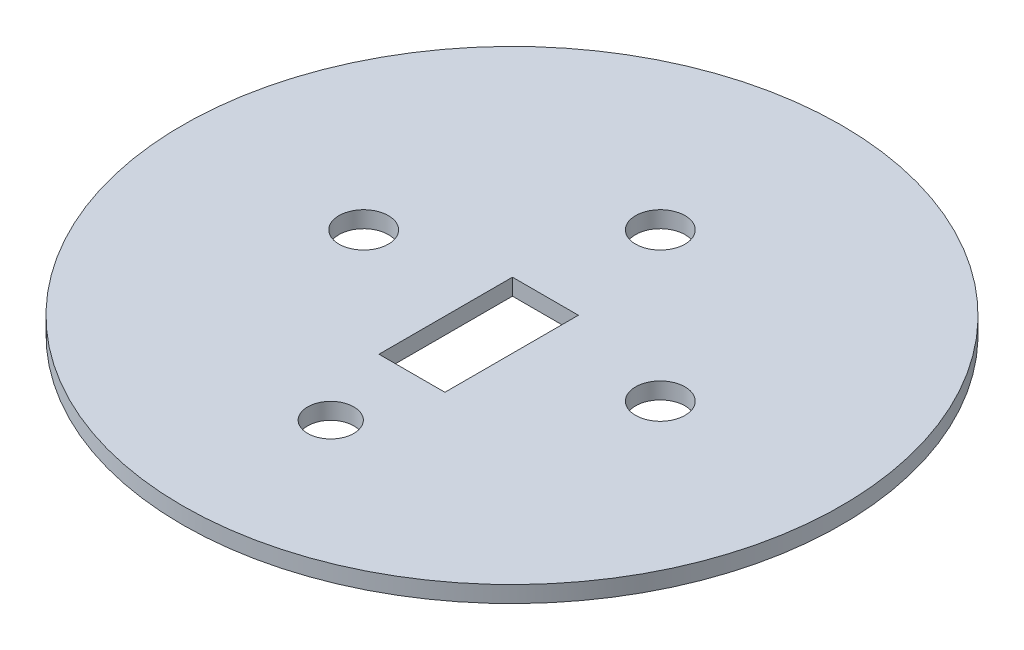
from build123d import *

# Parameters (mm, degrees)
SKETCH2_R           = 100
BOSS_EXTRUDE1_DEPTH = 2.5
CUT_EXTRUDE1_DEPTH  = 2.5
CUT_EXTRUDE2_DEPTH  = 10
SKETCH6_R           = 7.5
SKETCH6_R_2         = 7
CUT_EXTRUDE3_DEPTH  = 10


with BuildPart() as part:
    # Sketch2 → Boss-Extrude1 (new, symmetric)
    with BuildSketch(Plane(origin=(0, 0, 0), x_dir=(1, 0, 0), z_dir=(0, 1, 0))):
        with Locations(Location((0, 0, 0), (0, 0, 270))):
            Circle(SKETCH2_R)
    extrude(amount=BOSS_EXTRUDE1_DEPTH, both=True)

    # Sketch3 → Cut-Extrude1 (cut)
    with BuildSketch(Plane.XZ.offset(2.5)):
        Polygon((-65, 0), (-65, -50), (-55, -50), (-55, 50), (-65, 50), align=None)
        Polygon((55, 50), (65, 50), (65, 0), (65, -50), (55, -50), align=None)
    extrude(amount=-CUT_EXTRUDE1_DEPTH, mode=Mode.SUBTRACT)

    # Sketch5 → Cut-Extrude2 (cut)
    with BuildSketch(Plane.XZ.offset(2.5)):
        Polygon((0, 30.36), (10, 30.36), (10, -10.14), (-10, -10.14), (-10, 30.36), align=None)
    extrude(amount=-CUT_EXTRUDE2_DEPTH, mode=Mode.SUBTRACT)

    # Sketch6 → Cut-Extrude3 (cut)
    with BuildSketch(Plane.XZ.offset(2.5)):
        with Locations(Location((-45, 0, 0), (0, 0, 270))):
            Circle(SKETCH6_R)
        with Locations(Location((0, -45, 0), (0, 0, 270))):
            Circle(SKETCH6_R)
        with Locations(Location((45, 0, 0), (0, 0, 270))):
            Circle(SKETCH6_R)
        with Locations(Location((0, 55, 0), (0, 0, 270))):
            Circle(SKETCH6_R_2)
    extrude(amount=-CUT_EXTRUDE3_DEPTH, mode=Mode.SUBTRACT)


solid = part.part
